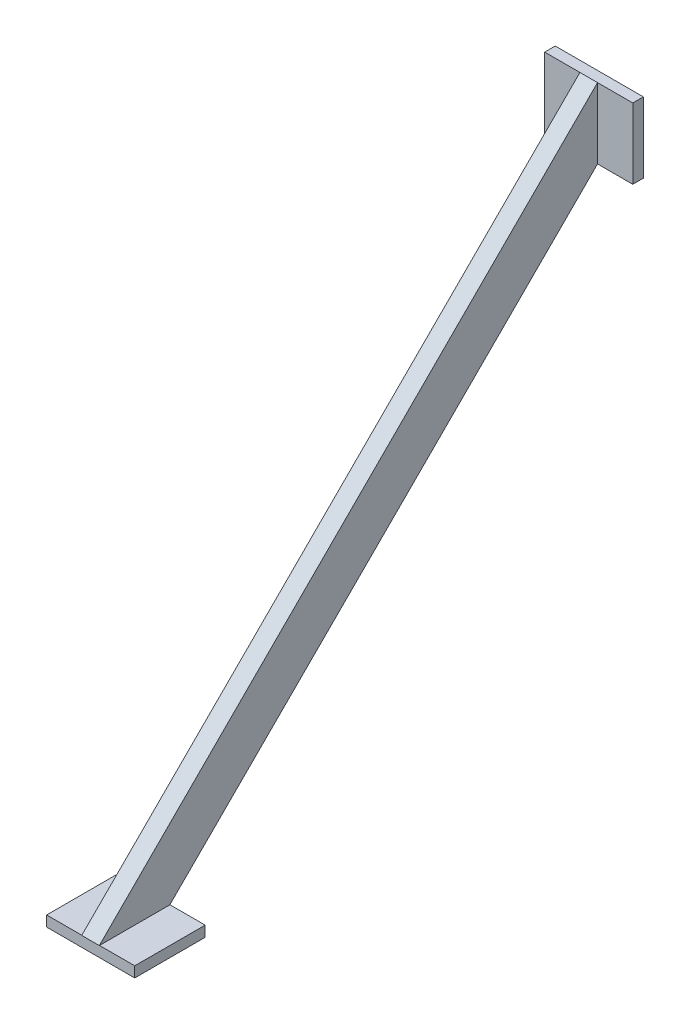
from build123d import *

# Parameters (mm, degrees)
BOSS_EXTRUDE1_DEPTH = 5
SKETCH2_W           = 25
SKETCH2_H           = 20
BOSS_EXTRUDE2_DEPTH = 3
BOSS_EXTRUDE3_DEPTH = 3


with BuildPart() as part:
    # Sketch1 → Boss-Extrude1 (new body)
    with BuildSketch(Plane(origin=(0, 0, 0), x_dir=(0, 0, -1), z_dir=(1, 0, 0))):
        Polygon((106.664666231, 114.512097991), (-34.756690006, -26.909258246), (-14.756690006, -26.909258246), (106.664666231, 94.512097991), align=None)
    extrude(amount=BOSS_EXTRUDE1_DEPTH)

    # Sketch2 → Boss-Extrude2 (add)
    with BuildSketch(Plane.XZ.offset(26.909258246)):
        with Locations((2.5, 24.703284183)):
            Rectangle(SKETCH2_W, SKETCH2_H)
    extrude(amount=BOSS_EXTRUDE2_DEPTH)

    # Sketch3 → Boss-Extrude3 (add)
    with BuildSketch(Plane(origin=(0, 0, -106.664666231), x_dir=(-1, 0, 0), z_dir=(0, 0, -1))):
        Polygon((8.72832764, 94.512097991), (10, 94.512097991), (10, 114.512097991), (-15, 114.512097991), (-15, 94.512097991), align=None)
    extrude(amount=BOSS_EXTRUDE3_DEPTH)


solid = part.part
